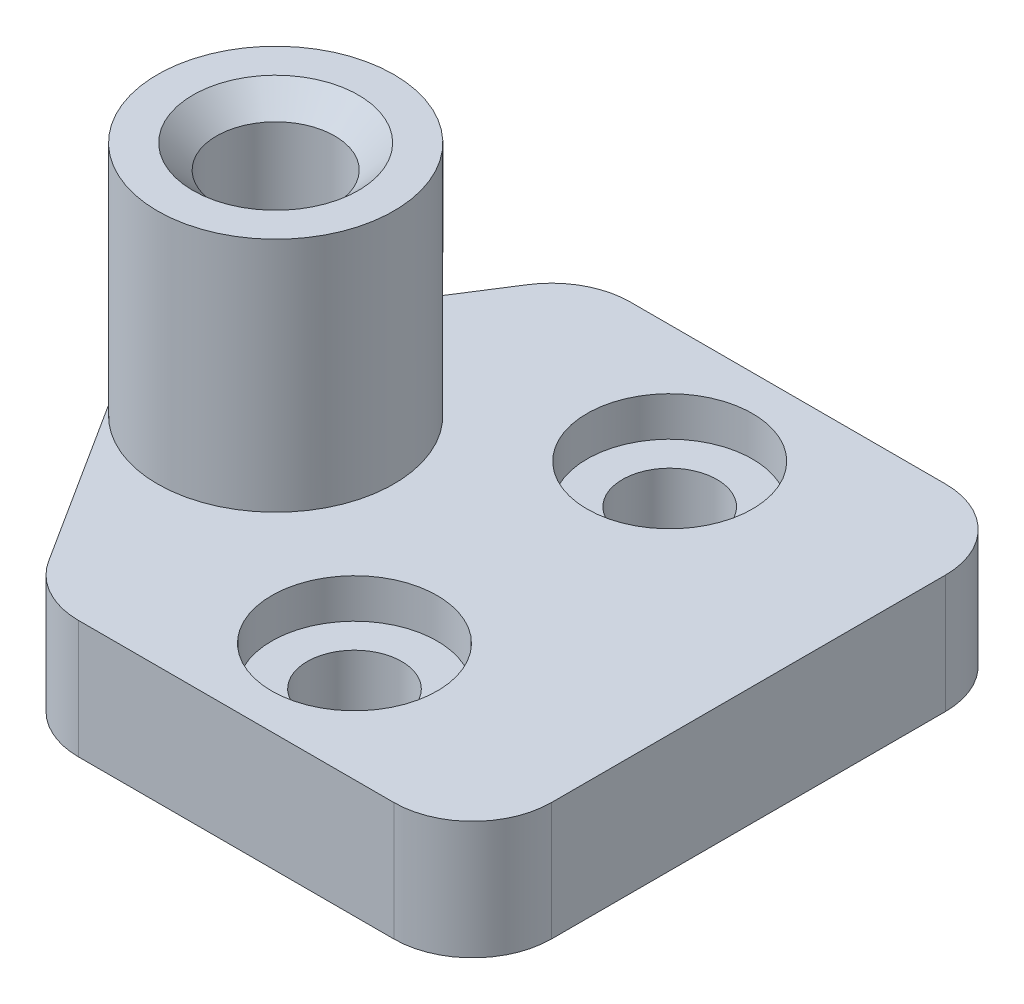
from build123d import *

# Parameters (mm, degrees)
SKETCH1_W                       = 12
SKETCH1_H                       = 14
SKETCH1_R                       = 1.2
BOSS_EXTRUDE1_DEPTH             = 3
SKETCH3_R                       = 3
BOSS_EXTRUDE2_DEPTH             = 6
BOSS_EXTRUDE2_DIRECTION_2_REACH = 11.695
FILLET1_R                       = 2
BOSS_EXTRUDE3_DEPTH             = 3
SKETCH6_R                       = 2.1
CUT_EXTRUDE2_DEPTH              = 1
SKETCH10_R                      = 1.5
CUT_EXTRUDE3_DEPTH              = 6
CHAMFER1_SIZE                   = 0.6


with BuildPart() as part:
    # Sketch1 → Boss-Extrude1 (new body)
    with BuildSketch(Plane(origin=(0, 0, 0), x_dir=(1, 0, 0), z_dir=(0, 1, 0))):
        Rectangle(SKETCH1_W, SKETCH1_H)
        with Locations(Location((0, 4, 0), (0, 0, 270))):
            Circle(SKETCH1_R, mode=Mode.SUBTRACT)
        with Locations(Location((0, -4, 0), (0, 0, 270))):
            Circle(SKETCH1_R, mode=Mode.SUBTRACT)
    extrude(amount=BOSS_EXTRUDE1_DEPTH)

    # Sketch3 → Boss-Extrude2 (add)
    with BuildSketch(Plane(origin=(0, 3, 0), x_dir=(1, 0, 0), z_dir=(0, 1, 0))):
        with Locations(Location((-6, 0, 0), (0, 0, 270))):
            Circle(SKETCH3_R)
    extrude(amount=BOSS_EXTRUDE2_DEPTH)

    # Boss-Extrude2 direction 2: up to this face of the body (flat: up to its plane)
    boss_extrude2_direction_2_end = Plane(part.part.faces().sort_by_distance((0, 0, 0))[0])
    # Sketch3 → Boss-Extrude2 direction 2 (add, up to the picked face)
    with BuildSketch(Plane(origin=(0, 3, 0), x_dir=(1, 0, 0), z_dir=(0, 1, 0)), mode=Mode.PRIVATE) as boss_extrude2_direction_2_sk1:
        with Locations(Location((-6, 0, 0), (0, 0, 270))):
            Circle(SKETCH3_R)
    boss_extrude2_direction_2_tool1 = split(extrude(boss_extrude2_direction_2_sk1.sketch, amount=-BOSS_EXTRUDE2_DIRECTION_2_REACH, mode=Mode.PRIVATE), bisect_by=boss_extrude2_direction_2_end, keep=Keep.BOTH, mode=Mode.PRIVATE)
    add(boss_extrude2_direction_2_tool1.solids().sort_by(Axis((-6, 3, 0), (0, -1, 0)))[0])

    # Fillet1
    fillet1_edges = [part.edges().sort_by_distance(p)[0] for p in [
        (6, 1.5, 7),
        (-6, 1.5, 7),
        (-6, 1.5, -7),
        (6, 1.5, -7),
    ]]
    fillet(fillet1_edges, radius=FILLET1_R)

    # Sketch5 → Boss-Extrude3 (add)
    with BuildSketch(Plane(origin=(0, 3, 0), x_dir=(1, 0, 0), z_dir=(0, 1, 0))):
        with BuildLine():
            Line((-8.530087563, 1.612035025), (-5.686725042, 6.074690017))
            ThreePointArc((-5.686725042, 6.074690017), (-5.920084645, 5.559709709), (-6, 5))
            Line((-6, 5), (-6, 3))
            ThreePointArc((-6, 3), (-7.442895513, 2.630219105), (-8.530087563, 1.612035025))
        make_face()
        with BuildLine():
            Line((-8.530087563, -1.612035025), (-5.686725042, -6.074690017))
            ThreePointArc((-5.686725042, -6.074690017), (-5.920084645, -5.559709709), (-6, -5))
            Line((-6, -5), (-6, -3))
            ThreePointArc((-6, -3), (-7.442895513, -2.630219105), (-8.530087563, -1.612035025))
        make_face()
    extrude(amount=-BOSS_EXTRUDE3_DEPTH)

    # Sketch6 → Cut-Extrude2 (cut)
    with BuildSketch(Plane(origin=(0, 3, 0), x_dir=(1, 0, 0), z_dir=(0, 1, 0))):
        with Locations(Location((0, 4, 0), (0, 0, 270))):
            Circle(SKETCH6_R)
        with Locations(Location((0, -4, 0), (0, 0, 270))):
            Circle(SKETCH6_R)
    extrude(amount=-CUT_EXTRUDE2_DEPTH, mode=Mode.SUBTRACT)

    # Sketch10 → Cut-Extrude3 (cut)
    with BuildSketch(Plane(origin=(0, 9, 0), x_dir=(1, 0, 0), z_dir=(0, 1, 0))):
        with Locations(Location((-6, 0, 0), (0, 0, 270))):
            Circle(SKETCH10_R)
    extrude(amount=-CUT_EXTRUDE3_DEPTH, mode=Mode.SUBTRACT)

    # Chamfer1
    chamfer1_edges = [part.edges().sort_by_distance(p)[0] for p in [
        (-6, 9, -1.5),
    ]]
    chamfer(chamfer1_edges, length=CHAMFER1_SIZE)


solid = part.part
